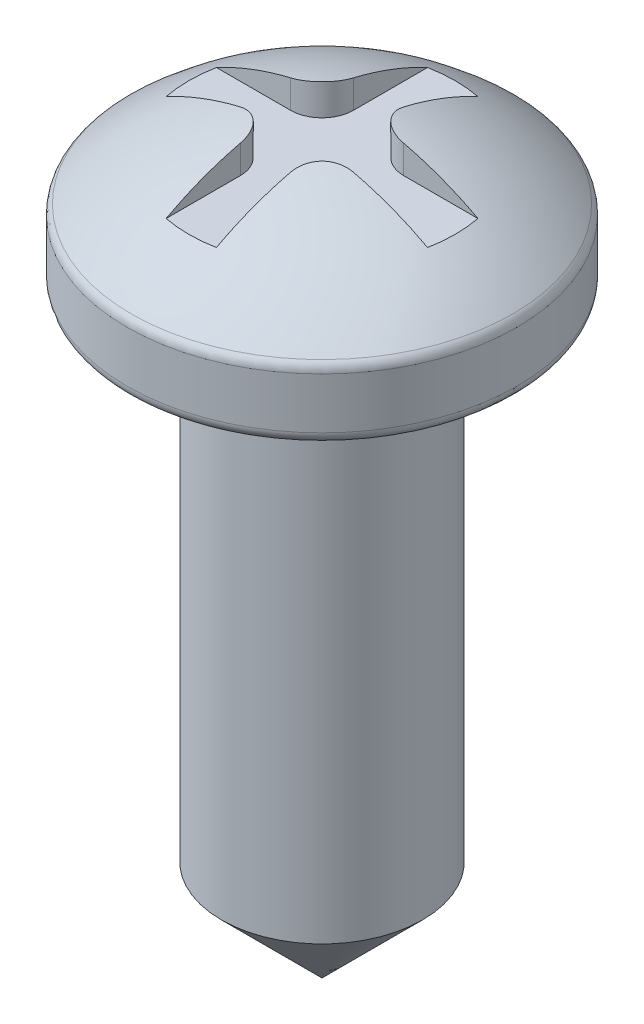
from build123d import *

# Parameters (mm, degrees)
CORTAR_EXTRUIR1_START = -1.8
CORTAR_EXTRUIR1_DEPTH = 3


with BuildPart() as part:
    # Croquis1 → Revolución1 (revolve)
    with BuildSketch(Plane.XY, mode=Mode.PRIVATE) as revoluci_n1_sk:
        with BuildLine():
            Line((0, 0), (0, 11.9))
            ThreePointArc((0, 11.9), (1.620417383, 11.535759883), (3.032129542, 10.660835807))
            ThreePointArc((3.032129542, 10.660835807), (3.082244216, 10.59308012), (3.1, 10.510696592))
            Line((3.1, 10.510696592), (3.1, 9.7))
            ThreePointArc((3.1, 9.7), (3.041421356, 9.558578644), (2.9, 9.5))
            Line((2.9, 9.5), (1.6, 9.5))
            Line((1.6, 9.5), (1.6, 1.6))
            Line((1.6, 1.6), (0, 0))
        make_face()
    revolve(revoluci_n1_sk.sketch.rotate(Axis((0, 0, 0), (0, 1, 0)), 90), axis=Axis((0, 0, 0), (0, 1, 0)))

    # Croquis2 → Cortar-Extruir1 (cut)
    with BuildSketch(Plane.XZ.offset(-9.5).offset(CORTAR_EXTRUIR1_START)):
        with BuildLine():
            Line((-0.4, 3.2), (-0.4, 0.9))
            ThreePointArc((-0.4, 0.9), (-0.546446609, 0.546446609), (-0.9, 0.4))
            Line((-0.9, 0.4), (-3.2, 0.4))
            Line((-3.2, 0.4), (-3.2, -0.4))
            Line((-3.2, -0.4), (-0.9, -0.4))
            ThreePointArc((-0.9, -0.4), (-0.546446609, -0.546446609), (-0.4, -0.9))
            Line((-0.4, -0.9), (-0.4, -3.2))
            Line((-0.4, -3.2), (0.4, -3.2))
            Line((0.4, -3.2), (0.4, -0.9))
            ThreePointArc((0.4, -0.9), (0.546446609, -0.546446609), (0.9, -0.4))
            Line((0.9, -0.4), (3.2, -0.4))
            Line((3.2, -0.4), (3.2, 0.4))
            Line((3.2, 0.4), (0.9, 0.4))
            ThreePointArc((0.9, 0.4), (0.546446609, 0.546446609), (0.4, 0.9))
            Line((0.4, 0.9), (0.4, 3.2))
            Line((0.4, 3.2), (-0.4, 3.2))
        make_face()
    extrude(amount=-CORTAR_EXTRUIR1_DEPTH, mode=Mode.SUBTRACT)


solid = part.part
